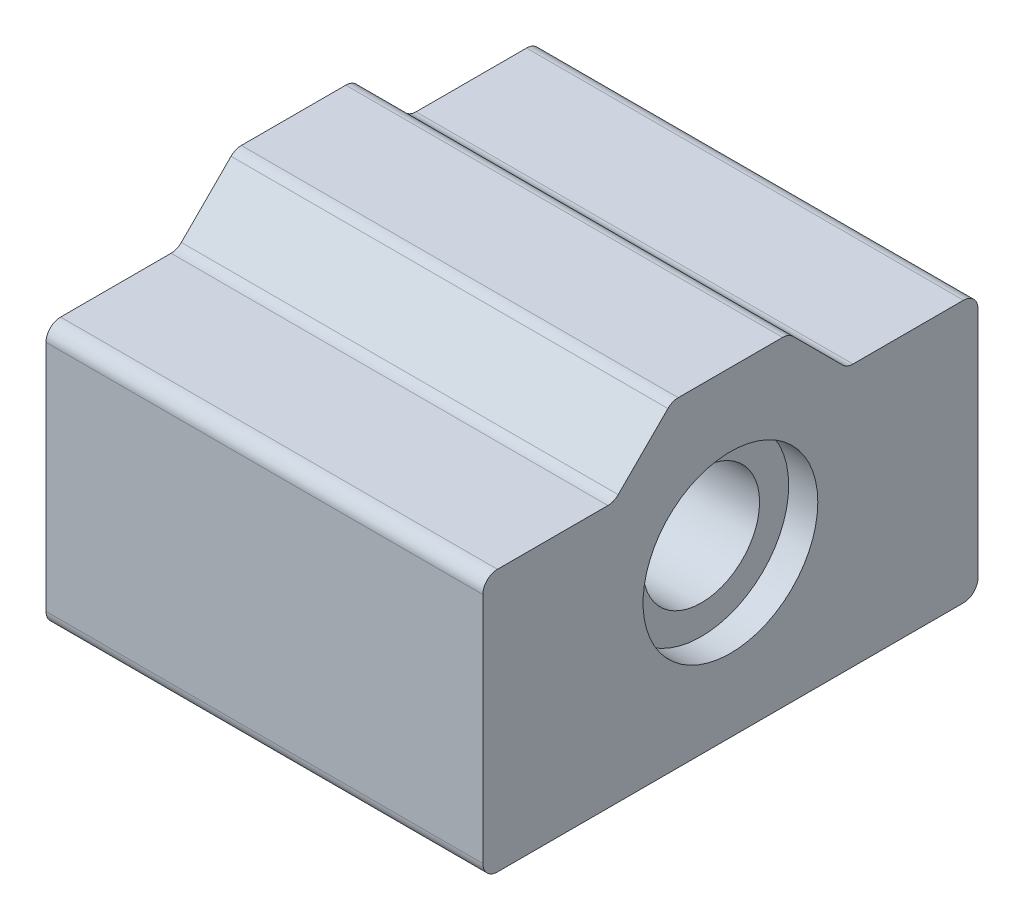
from build123d import *

# Parameters (mm, degrees)
SKETCH_1_R          = 4
EXTRUDE_1_DEPTH     = 30
SKETCH_6_R          = 2
CUT_EXTRUDE_5_DEPTH = 8
SKETCH_7_R          = 6
CUT_EXTRUDE_6_DEPTH = 2
CUT_EXTRUDE_START   = -2
SKETCH_8_R          = 6
CUT_EXTRUDE_7_DEPTH = 2


with BuildPart() as part:
    # 草图1 → 凸台-拉伸1 (new body)
    with BuildSketch(Plane(origin=(0, 0, 0), x_dir=(0, 0, -1), z_dir=(1, 0, 0))):
        with BuildLine():
            Line((-12.117188, -1), (-12.117188, -17))
            ThreePointArc((-12.117188, -17), (-11.824294782, -17.707106781), (-11.117188, -18))
            Line((-11.117188, -18), (20.882812, -18))
            ThreePointArc((20.882812, -18), (21.589918781, -17.707106781), (21.882812, -17))
            Line((21.882812, -17), (21.882812, -1))
            ThreePointArc((21.882812, -1), (21.589918781, -0.292893219), (20.882812, 0))
            Line((20.882812, 0), (13.297025562, 0))
            ThreePointArc((13.297025562, 0), (12.91434213, 0.076120467), (12.589918781, 0.292893219))
            Line((12.589918781, 0.292893219), (9.175705218, 3.707106781))
            ThreePointArc((9.175705218, 3.707106781), (8.85128187, 3.923879533), (8.468598437, 4))
            Line((8.468598437, 4), (1.297025562, 4))
            ThreePointArc((1.297025562, 4), (0.91434213, 3.923879533), (0.589918781, 3.707106781))
            Line((0.589918781, 3.707106781), (-2.824294782, 0.292893219))
            ThreePointArc((-2.824294782, 0.292893219), (-3.14871813, 0.076120467), (-3.531401563, 0))
            Line((-3.531401563, 0), (-11.117188, 0))
            ThreePointArc((-11.117188, 0), (-11.824294782, -0.292893219), (-12.117188, -1))
        make_face()
        with Locations((4.882812, -7)):
            Circle(SKETCH_1_R, mode=Mode.SUBTRACT)
    extrude(amount=EXTRUDE_1_DEPTH)

    # 草图6 → 切除-拉伸5 (cut)
    with BuildSketch(Plane.XZ.offset(18)):
        with Locations(Location((24, -16.882812, 0), (0, 0, 270))):
            Circle(SKETCH_6_R)
        with Locations(Location((6, -16.882812, 0), (0, 0, 270))):
            Circle(SKETCH_6_R)
        with Locations(Location((6, 7.117188, 0), (0, 0, 270))):
            Circle(SKETCH_6_R)
        with Locations(Location((24, 7.117188, 0), (0, 0, 270))):
            Circle(SKETCH_6_R)
    extrude(amount=-CUT_EXTRUDE_5_DEPTH, mode=Mode.SUBTRACT)

    # 草图7 → 切除-拉伸6 (cut)
    with BuildSketch(Plane.ZY):
        with Locations((-4.882812, -7)):
            Circle(SKETCH_7_R)
    extrude(amount=-CUT_EXTRUDE_6_DEPTH, mode=Mode.SUBTRACT)

    # 草图8 → 切除-拉伸7 (cut)
    with BuildSketch(Plane(origin=(30, 0, 0), x_dir=(0, 0, -1), z_dir=(1, 0, 0)).offset(CUT_EXTRUDE_START)):
        with Locations(Location((4.882812, -7, 0), (0, 0, 180))):
            Circle(SKETCH_8_R)
    extrude(amount=CUT_EXTRUDE_7_DEPTH, mode=Mode.SUBTRACT)


solid = part.part
